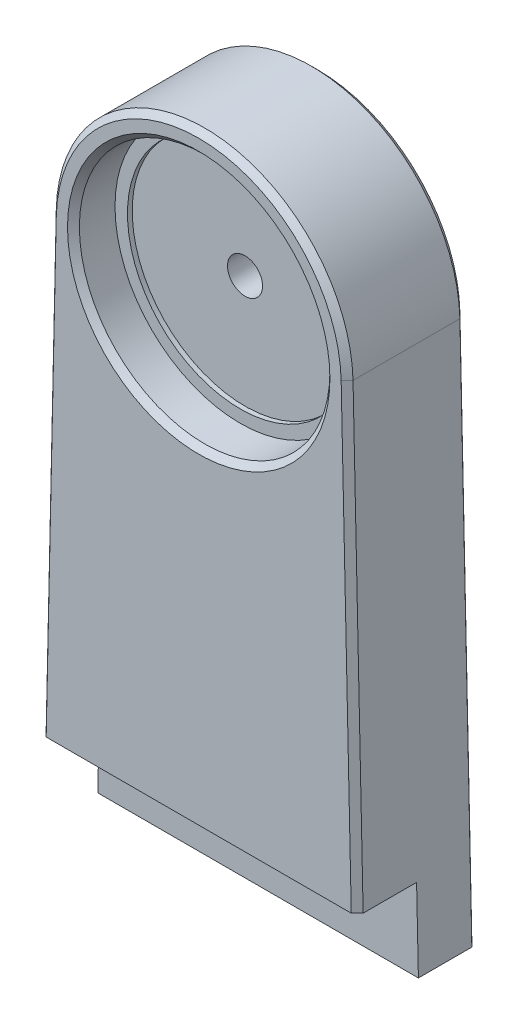
from build123d import *

# Parameters (mm, degrees)
SKETCH_2_R          = 2.95
SKETCH_2_R_2        = 1.55
EXTRUDE_1_DEPTH     = 20
SKETCH_3_W          = 53.999961589
SKETCH_3_H          = 13.8
CUT_EXTRUDE_1_DEPTH = 10
SKETCH_4_R          = 21.1
CUT_EXTRUDE_2_DEPTH = 7
SKETCH_5_R          = 19
CUT_EXTRUDE_3_DEPTH = 0.8
CHAMFER_1_SIZE      = 1
SKETCH_6_R          = 3
CUT_EXTRUDE_4_DEPTH = 3


with BuildPart() as part:
    # 草图2 → 凸台-拉伸1 (new body)
    with BuildSketch(Plane.XY):
        with BuildLine():
            Line((-24.99119492, 0.663496162), (-27, -90))
            Line((-27, -90), (0, -90))
            Line((0, -90), (26.999961589, -90))
            Line((26.999961589, -90), (24.991195257, 0.663483484))
            ThreePointArc((24.991195257, 0.663483484), (6.341e-06, 25.000001014), (-24.99119492, 0.663496162))
        make_face()
        Circle(SKETCH_2_R, mode=Mode.SUBTRACT)
        with Locations((-15, -83)):
            Circle(SKETCH_2_R_2, mode=Mode.SUBTRACT)
        with Locations((0, -83)):
            Circle(SKETCH_2_R_2, mode=Mode.SUBTRACT)
        with Locations((15, -83)):
            Circle(SKETCH_2_R_2, mode=Mode.SUBTRACT)
    extrude(amount=EXTRUDE_1_DEPTH)

    # 草图3 → 切除-拉伸1 (cut)
    with BuildSketch(Plane.XY.offset(20)):
        with Locations((-1.9205e-05, -83.1)):
            Rectangle(SKETCH_3_W, SKETCH_3_H)
    extrude(amount=-CUT_EXTRUDE_1_DEPTH, mode=Mode.SUBTRACT)

    # 草图4 → 切除-拉伸2 (cut)
    with BuildSketch(Plane.XY.offset(20)):
        Circle(SKETCH_4_R)
    extrude(amount=-CUT_EXTRUDE_2_DEPTH, mode=Mode.SUBTRACT)

    # 草图5 → 切除-拉伸3 (cut)
    with BuildSketch(Plane.XY.offset(13)):
        Circle(SKETCH_5_R)
    extrude(amount=-CUT_EXTRUDE_3_DEPTH, mode=Mode.SUBTRACT)

    # 倒角1
    chamfer_1_edges = [part.edges().sort_by_distance(p)[0] for p in [
        (25.84270003, -37.768258258, 20),
        (6.341e-06, 25.000001014, 20),
        (25.995578423, -44.668258258, 0),
        (-21.1, 0, 20),
        (-25.99559746, -44.668251919, 0),
        (6.341e-06, 25.000001014, 0),
        (-25.842716139, -37.768251919, 20),
    ]]
    chamfer(chamfer_1_edges, length=CHAMFER_1_SIZE)

    # 草图6 → 切除-拉伸4 (cut)
    with BuildSketch(Plane(origin=(0, 0, 0), x_dir=(-1, 0, 0), z_dir=(0, 0, -1))):
        with Locations((-15, -83)):
            Circle(SKETCH_6_R)
        with Locations((0, -83)):
            Circle(SKETCH_6_R)
        with Locations((15, -83)):
            Circle(SKETCH_6_R)
    extrude(amount=-CUT_EXTRUDE_4_DEPTH, mode=Mode.SUBTRACT)


solid = part.part
